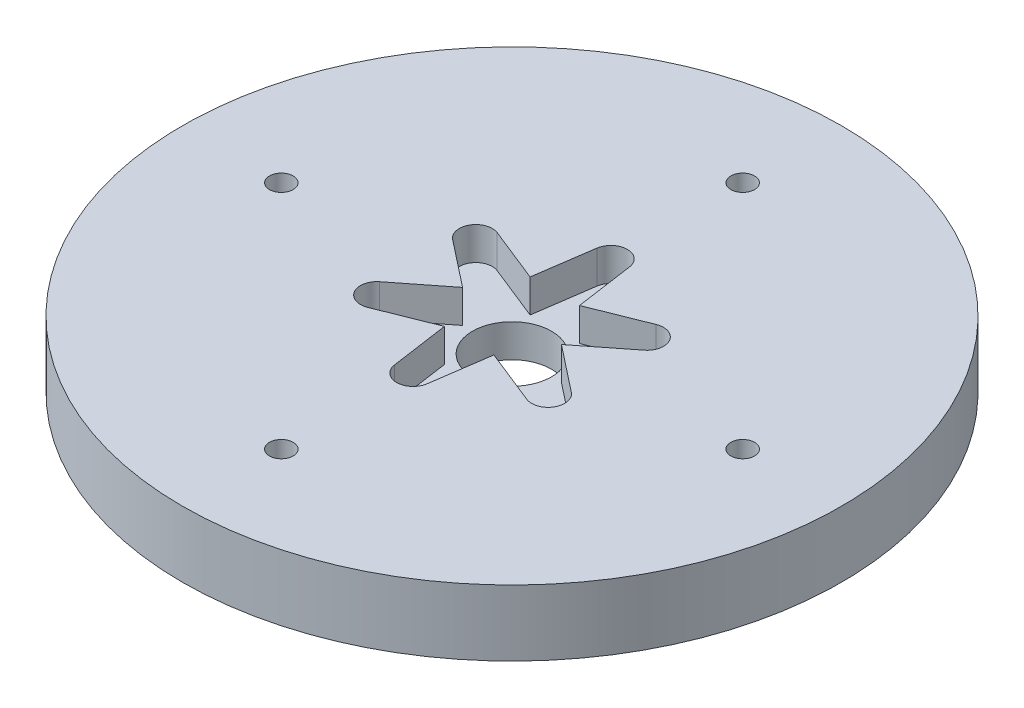
from build123d import *

# Parameters (mm, degrees)
SKETCH1_R           = 50
SKETCH1_R_2         = 1.8
BOSS_EXTRUDE1_DEPTH = 5
BOSS_EXTRUDE2_START = 5
SKETCH2_R           = 50
SKETCH2_R_2         = 1.8
SKETCH2_R_3         = 6
BOSS_EXTRUDE2_DEPTH = 5


with BuildPart() as part:
    # Sketch1 → Boss-Extrude1 (new body)
    with BuildSketch(Plane(origin=(0, 0, 0), x_dir=(1, 0, 0), z_dir=(0, 1, 0))):
        with Locations(Location((0, 0, 0), (0, 0, 270))):
            Circle(SKETCH1_R)
        with Locations(Location((0, 35, 0), (0, 0, 270))):
            Circle(SKETCH1_R_2, mode=Mode.SUBTRACT)
        with Locations(Location((35, 0, 0), (0, 0, 270))):
            Circle(SKETCH1_R_2, mode=Mode.SUBTRACT)
        with Locations(Location((0, -35, 0), (0, 0, 270))):
            Circle(SKETCH1_R_2, mode=Mode.SUBTRACT)
        with Locations(Location((-35, 0, 0), (0, 0, 270))):
            Circle(SKETCH1_R_2, mode=Mode.SUBTRACT)
        with BuildLine():
            Line((-3.75, 6.5), (-2.47446787, 15.356382884))
            ThreePointArc((-2.47446787, 15.356382884), (0, 17.5), (2.47446787, 15.356382884))
            Line((2.47446787, 15.356382884), (3.75, 6.5))
            Line((3.75, 6.5), (3.754165125, 6.497595264))
            Line((3.754165125, 6.497595264), (12.061783753, 9.821143478))
            ThreePointArc((12.061783753, 9.821143478), (15.155444566, 8.75), (14.536251623, 5.535239406))
            Line((14.536251623, 5.535239406), (7.504165125, 0.002404736))
            Line((7.504165125, 0.002404736), (7.504165125, -0.002404736))
            Line((7.504165125, -0.002404736), (14.536251623, -5.535239406))
            ThreePointArc((14.536251623, -5.535239406), (15.155444566, -8.75), (12.061783753, -9.821143478))
            Line((12.061783753, -9.821143478), (3.754165125, -6.497595264))
            Line((3.754165125, -6.497595264), (3.75, -6.5))
            Line((3.75, -6.5), (2.47446787, -15.356382884))
            ThreePointArc((2.47446787, -15.356382884), (0, -17.5), (-2.47446787, -15.356382884))
            Line((-2.47446787, -15.356382884), (-3.75, -6.5))
            Line((-3.75, -6.5), (-3.754165125, -6.497595264))
            Line((-3.754165125, -6.497595264), (-12.061783753, -9.821143478))
            ThreePointArc((-12.061783753, -9.821143478), (-15.155444566, -8.75), (-14.536251623, -5.535239406))
            Line((-14.536251623, -5.535239406), (-7.504165125, -0.002404736))
            Line((-7.504165125, -0.002404736), (-7.504165125, 0.002404736))
            Line((-7.504165125, 0.002404736), (-14.536251623, 5.535239406))
            ThreePointArc((-14.536251623, 5.535239406), (-15.155444566, 8.75), (-12.061783753, 9.821143478))
            Line((-12.061783753, 9.821143478), (-3.754165125, 6.497595264))
            Line((-3.754165125, 6.497595264), (-3.75, 6.5))
        make_face(mode=Mode.SUBTRACT)
    extrude(amount=BOSS_EXTRUDE1_DEPTH)

    # Sketch2 → Boss-Extrude2 (add)
    with BuildSketch(Plane.XZ.offset(BOSS_EXTRUDE2_START)):
        with Locations(Location((0, 0, 0), (0, 0, 270))):
            Circle(SKETCH2_R)
        with Locations(Location((-35, 0, 0), (0, 0, 270))):
            Circle(SKETCH2_R_2, mode=Mode.SUBTRACT)
        with Locations(Location((0, 35, 0), (0, 0, 270))):
            Circle(SKETCH2_R_2, mode=Mode.SUBTRACT)
        with Locations(Location((35, 0, 0), (0, 0, 270))):
            Circle(SKETCH2_R_2, mode=Mode.SUBTRACT)
        with Locations(Location((0, -35, 0), (0, 0, 270))):
            Circle(SKETCH2_R_2, mode=Mode.SUBTRACT)
        with Locations(Location((0, 0, 0), (0, 0, 270))):
            Circle(SKETCH2_R_3, mode=Mode.SUBTRACT)
    extrude(amount=-BOSS_EXTRUDE2_DEPTH)


solid = part.part
